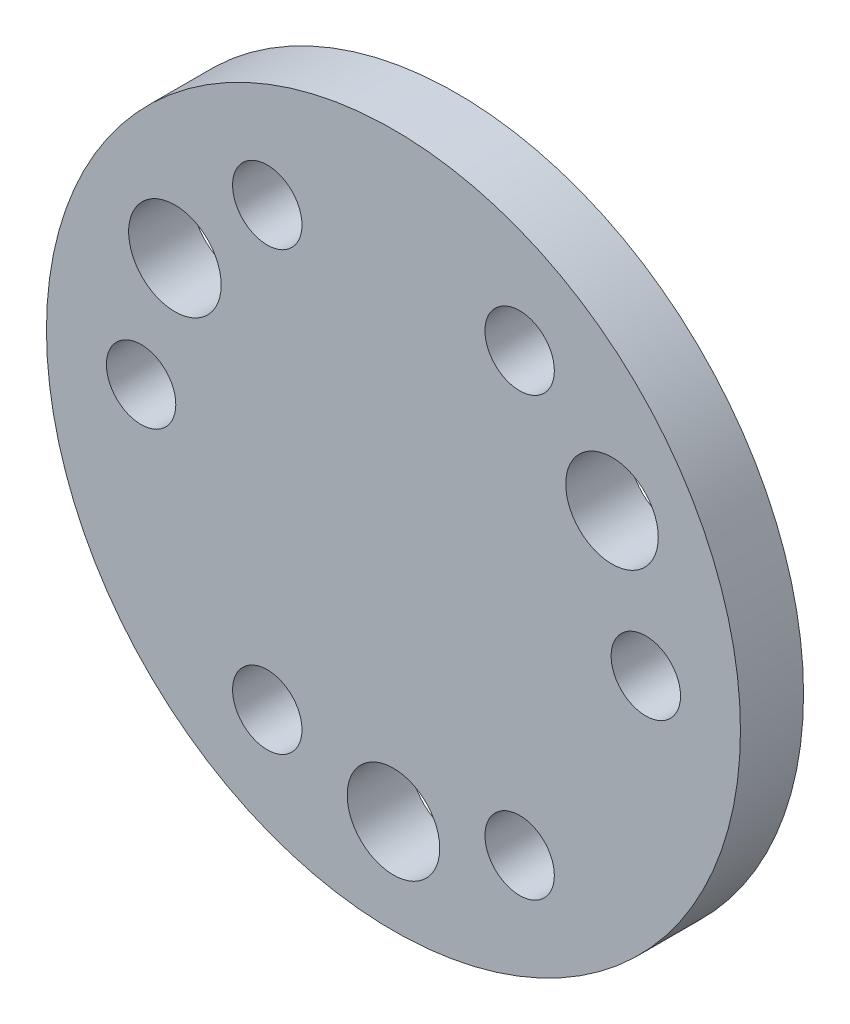
from build123d import *

# Parameters (mm, degrees)
SKETCH_2_R      = 16.5
SKETCH_2_R_2    = 2.2
SKETCH_2_R_3    = 1.65
EXTRUDE_1_DEPTH = 3


with BuildPart() as part:
    # 草图2 → 凸台-拉伸1 (new body)
    with BuildSketch(Plane.XY):
        Circle(SKETCH_2_R)
        with Locations((-10.392304845, 6)):
            Circle(SKETCH_2_R_2, mode=Mode.SUBTRACT)
        with Locations((-6, 10.392304845)):
            Circle(SKETCH_2_R_3, mode=Mode.SUBTRACT)
        with Locations((-12, 0)):
            Circle(SKETCH_2_R_3, mode=Mode.SUBTRACT)
        with Locations((6, 10.392304845)):
            Circle(SKETCH_2_R_3, mode=Mode.SUBTRACT)
        with Locations((10.392304845, 6)):
            Circle(SKETCH_2_R_2, mode=Mode.SUBTRACT)
        with Locations((12, 0)):
            Circle(SKETCH_2_R_3, mode=Mode.SUBTRACT)
        with Locations((6, -10.392304845)):
            Circle(SKETCH_2_R_3, mode=Mode.SUBTRACT)
        with Locations((0, -12)):
            Circle(SKETCH_2_R_2, mode=Mode.SUBTRACT)
        with Locations((-6, -10.392304845)):
            Circle(SKETCH_2_R_3, mode=Mode.SUBTRACT)
    extrude(amount=EXTRUDE_1_DEPTH)


solid = part.part
